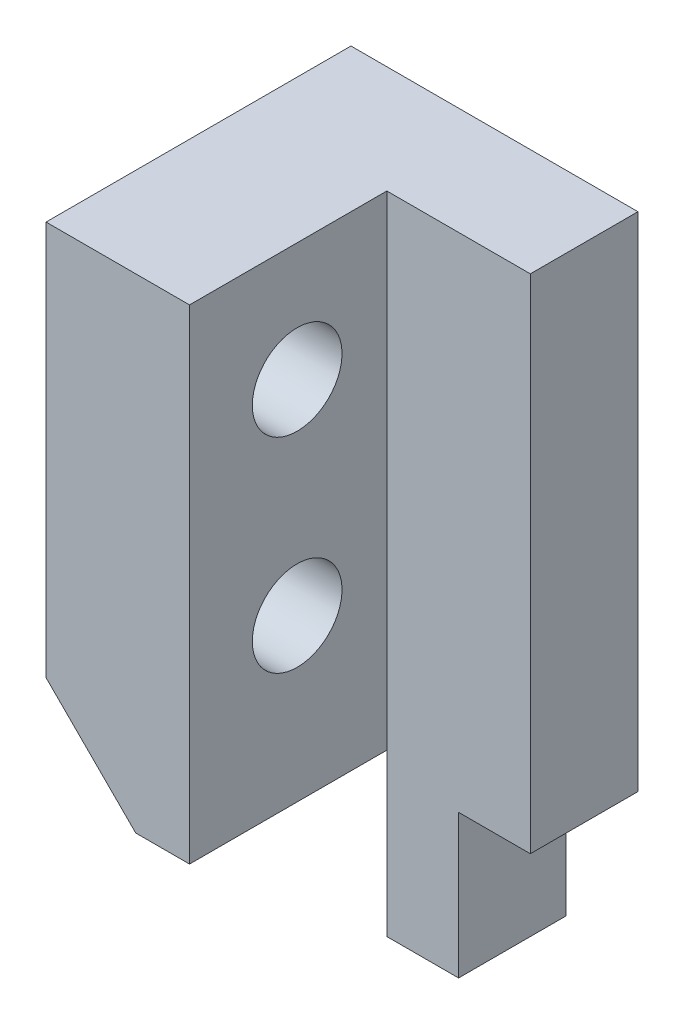
from build123d import *

# Parameters (mm, degrees)
SKETCH_1_W          = 8
SKETCH_1_H          = 18
EXTRUDE_1_DEPTH     = 8.5
SKETCH_2_W          = 4
SKETCH_2_H          = 5.5
CUT_EXTRUDE_1_DEPTH = 22.453437953
HOLE_WIZARD_M3_1_D  = 2.5
SKETCH_5_W          = 5.5
SKETCH_5_H          = 4
CUT_EXTRUDE_2_DEPTH = 8.5
SKETCH_6_W          = 2
SKETCH_6_H          = 4
CUT_EXTRUDE_3_DEPTH = 21.451161336
SKETCH_7_W          = 4
SKETCH_7_H          = 4.5
CUT_EXTRUDE_4_DEPTH = 22.453437953
CHAMFER_1_SIZE      = 2.5


with BuildPart() as part:
    # 草图1 → 凸台-拉伸1 (new body)
    with BuildSketch(Plane.XY):
        with Locations((4, 9)):
            Rectangle(SKETCH_1_W, SKETCH_1_H)
    extrude(amount=EXTRUDE_1_DEPTH)

    # 草图2 → 切除-拉伸1 (cut, through all)
    with BuildSketch(Plane(origin=(0, 18, 0), x_dir=(1, 0, 0), z_dir=(0, 1, 0))):
        with Locations((6, -5.75)):
            Rectangle(SKETCH_2_W, SKETCH_2_H)
    extrude(amount=-CUT_EXTRUDE_1_DEPTH, mode=Mode.SUBTRACT)

    # M3 螺纹孔1 (through all)
    with Locations(Plane.ZY):
        with Locations((5.5, 14.7), (5.5, 9)):
            Hole(HOLE_WIZARD_M3_1_D / 2)

    # 草图5 → 切除-拉伸2 (cut)
    with BuildSketch(Plane(origin=(4, 0, 0), x_dir=(0, 0, -1), z_dir=(1, 0, 0))):
        with Locations((-5.75, 2)):
            Rectangle(SKETCH_5_W, SKETCH_5_H)
    extrude(amount=-CUT_EXTRUDE_2_DEPTH, mode=Mode.SUBTRACT)

    # 草图6 → 切除-拉伸3 (cut, through all)
    with BuildSketch(Plane.XY.offset(3)):
        with Locations((7, 2)):
            Rectangle(SKETCH_6_W, SKETCH_6_H)
    extrude(amount=-CUT_EXTRUDE_3_DEPTH, mode=Mode.SUBTRACT)

    # 草图7 → 切除-拉伸4 (cut, through all)
    with BuildSketch(Plane(origin=(0, 0, 0), x_dir=(-1, 0, 0), z_dir=(0, 0, -1))):
        with Locations((-2, 2.25)):
            Rectangle(SKETCH_7_W, SKETCH_7_H)
    extrude(amount=-CUT_EXTRUDE_4_DEPTH, mode=Mode.SUBTRACT)

    # 倒角1
    chamfer_1_edges = [part.edges().sort_by_distance(p)[0] for p in [
        (0, 4.5, 4.25),
    ]]
    chamfer(chamfer_1_edges, length=CHAMFER_1_SIZE)


solid = part.part
